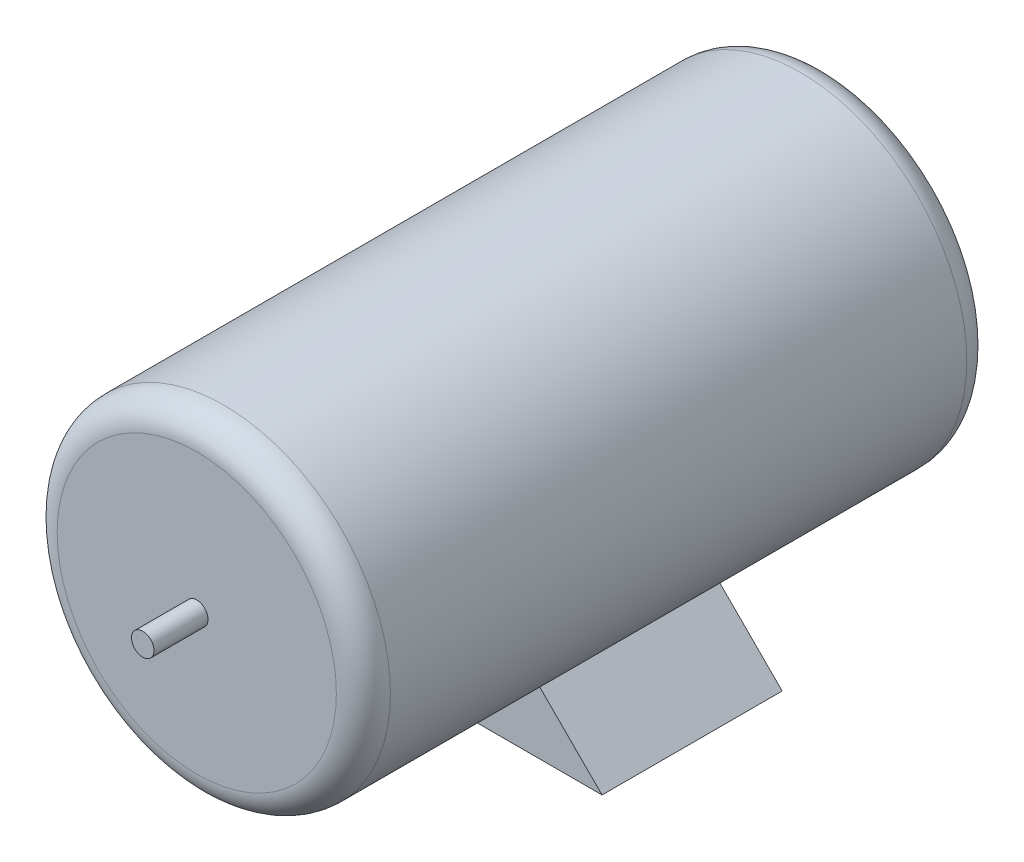
from build123d import *

# Parameters (mm, degrees)
SKETCH1_R           = 185
BOSS_EXTRUDE1_DEPTH = 350
FILLET1_R           = 30
BOSS_EXTRUDE2_DEPTH = 100
SKETCH3_R           = 12.5
BOSS_EXTRUDE3_DEPTH = 60


with BuildPart() as part:
    # Sketch1 → Boss-Extrude1 (new, symmetric)
    with BuildSketch(Plane.XY):
        Circle(SKETCH1_R)
    extrude(amount=BOSS_EXTRUDE1_DEPTH, both=True)

    # Fillet1
    fillet1_edges = [part.edges().sort_by_distance(p)[0] for p in [
        (-185, 0, -350),
        (-185, 0, 350),
    ]]
    fillet(fillet1_edges, radius=FILLET1_R)

    # Sketch2 → Boss-Extrude2 (add, symmetric)
    with BuildSketch(Plane.XY):
        Polygon((0, 0), (200, -200), (-200, -200), align=None)
    extrude(amount=BOSS_EXTRUDE2_DEPTH, both=True)

    # Sketch3 → Boss-Extrude3 (add)
    with BuildSketch(Plane.XY.offset(350)):
        Circle(SKETCH3_R)
    extrude(amount=BOSS_EXTRUDE3_DEPTH)


solid = part.part
